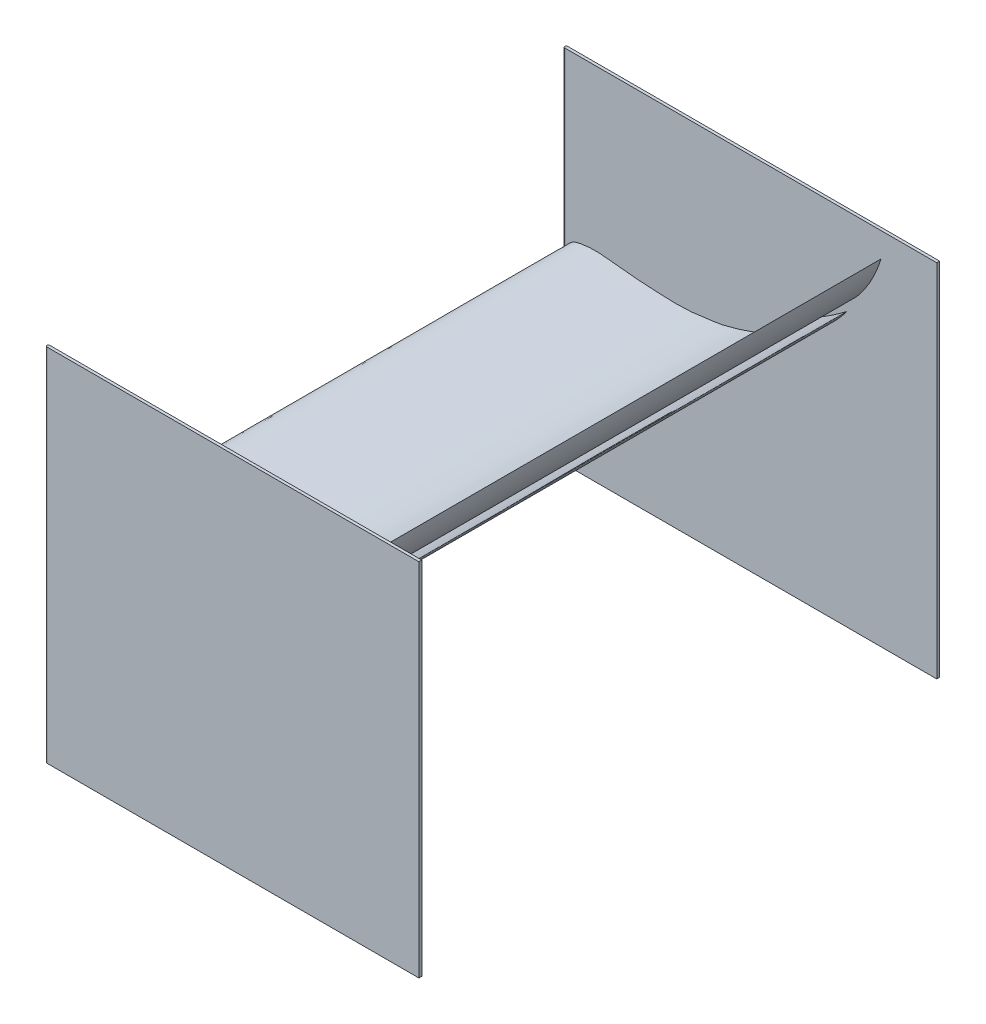
from build123d import *

# Parameters (mm, degrees)
BOSS_EXTRUDE1_DEPTH   = 900
BOSS_EXTRUDE1_2_DEPTH = 900
BOSS_EXTRUDE1_3_DEPTH = 900
SKETCH3_W             = 650
SKETCH3_H             = 630
BOSS_EXTRUDE2_DEPTH   = 5
SKETCH5_W             = 650
SKETCH5_H             = 630
BOSS_EXTRUDE3_DEPTH   = 5
BOSS_EXTRUDE4_DEPTH   = 630


with BuildPart() as part:
    # Sketch2 → Boss-Extrude1 (new body)
    with BuildSketch(Plane.XY):
        with BuildLine():
            add(Edge.make_bspline(
                [(0, 0), (-0.65975565, -5.699703464), (8.017548516, -15.480562025), (19.551157506, -21.724015646), (30.016745353, -25.302215165), (39.859962541, -28.8642232), (50.040399275, -30.662933418), (60.070603806, -32.257702331), (70.013877162, -34.217674322), (80.100972933, -34.55999195), (90.093066457, -35.36519438), (100.111969814, -35.952943269), (110.128217778, -35.507216678), (120.153157744, -35.210003546), (130.150331683, -34.229800116), (140.189993261, -33.410162922), (150.178235204, -31.913406007), (160.170449627, -30.371338734), (170.240789754, -29.163640841), (180.208316099, -27.151030087), (190.263801281, -25.306120223), (200.239152099, -22.872450662), (210.244577583, -20.429111012), (220.232934245, -17.895088966), (230.381125348, -15.705438437), (240.351948949, -12.391144832), (253.551193017, -7.369638816), (266.947574476, -2.806549313), (280.436865809, 1.636643436), (290.361357742, 5.819516769), (300.440735094, 10.032227759), (310.304777653, 14.884053202), (323.821431636, 20.884190166), (337.30228202, 27.249833417), (350.274680503, 34.850235797), (364.037447664, 41.200679435), (378.073354269, 50.431878374), (389.268655411, 56.991671546), (404.933124868, 70.670428585), (388.893146181, 60.897261379), (380.961681237, 56.833339948), (370.316551331, 52.173205743), (360.413556578, 47.749137904), (350.469658047, 43.075442492), (340.496714174, 38.833200032), (330.405194537, 35.260956145), (320.349773519, 31.849438488), (310.358327921, 28.32591748), (300.486931551, 24.662169398), (290.321799777, 22.300639283), (280.290360105, 19.76188557), (270.426731207, 16.765017679), (260.335958512, 15.061341224), (250.276874186, 13.958758108), (240.266180313, 12.578254982), (230.278688892, 11.06786106), (220.28670052, 9.696364143), (210.243264635, 9.240413966), (200.228739037, 9.034505305), (190.217040672, 8.279165066), (180.212460889, 9.162360851), (170.184221628, 8.728504773), (160.186505008, 9.582197967), (150.167787888, 9.989196896), (140.163470123, 10.700746944), (130.145958281, 11.214450998), (120.121382338, 11.840881885), (110.132801048, 12.969737489), (100.114836916, 13.850136605), (90.093770057, 14.715857774), (80.079633724, 15.842660607), (56.917746978, 18.847498868), (32.382831952, 18.963380484), (8.41761673, 12.262874152), (0.546057517, 4.717452477), (0, 0)],
                knots=[0, 0, 0, 0, 0.022023736, 0.035622153, 0.048196888, 0.060584536, 0.072602109, 0.084545422, 0.096478612, 0.108283816, 0.120089627, 0.131879307, 0.143660654, 0.15544949, 0.167268546, 0.17910001, 0.190991158, 0.20289685, 0.214787999, 0.226765538, 0.23876847, 0.250863752, 0.262991876, 0.27512, 0.287234564, 0.299600692, 0.31214973, 0.337081787, 0.34954249, 0.362249466, 0.375072168, 0.388091419, 0.401030286, 0.427260863, 0.440708926, 0.453891579, 0.481343844, 0.495528159, 0.510184265, 0.522427916, 0.535732546, 0.548643086, 0.561553626, 0.574510663, 0.587286643, 0.599816472, 0.612271303, 0.624763182, 0.637218013, 0.649381244, 0.661544475, 0.673750263, 0.685718325, 0.697586388, 0.709471547, 0.721375261, 0.733243324, 0.745039761, 0.756824219, 0.768610895, 0.780397571, 0.792175284, 0.803971722, 0.815766061, 0.82756692, 0.839363385, 0.851169099, 0.863005976, 0.874833225, 0.886659586, 0.898509641, 0.910371212, 0.969295412, 0.981771696, 1, 1, 1, 1], degree=3))
        make_face()
    extrude(amount=BOSS_EXTRUDE1_DEPTH)



with BuildPart() as body_2:
    # Sketch2 → Boss-Extrude1 2 (new body)
    with BuildSketch(Plane.XY):
        with BuildLine():
            add(Edge.make_bspline(
                [(488.73992863, 146.276625829), (488.734390863, 146.282664356), (488.424255517, 146.015046997), (488.06224571, 145.78510435), (487.262468982, 145.126312202), (486.219708703, 144.371292999), (484.873478649, 143.336701677), (483.250678892, 142.116067573), (481.344943871, 140.702556836), (479.183854282, 139.108333078), (476.761259361, 137.364331889), (474.123745832, 135.449437464), (471.236790602, 133.439330858), (468.165688429, 131.291310186), (464.896239769, 129.067635846), (461.457519682, 126.769533617), (457.874048726, 124.410588123), (454.151349507, 122.026984888), (450.329646269, 119.608278587), (446.41836705, 117.19210493), (442.442349173, 114.792641259), (438.43193703, 112.415341988), (434.42114363, 110.058907294), (430.419325782, 107.74839744), (426.469079038, 105.475179612), (422.572434597, 103.270040027), (418.782946314, 101.105445668), (415.103822048, 99.01892845), (411.581105321, 96.980001912), (408.223119368, 95.024650916), (405.070149132, 93.117181313), (402.117764879, 91.312769814), (399.415735867, 89.554324386), (396.965291652, 87.893504979), (394.792388291, 86.318571947), (392.915837215, 84.829964237), (391.349809227, 83.430905822), (390.083467317, 82.150893966), (389.152598068, 80.964624913), (388.566460536, 79.872034746), (388.31048608, 78.86894122), (388.452520239, 77.947544055), (389.013376817, 77.204475769), (389.915554573, 76.684991476), (391.128157446, 76.384212118), (392.650081725, 76.254634507), (394.48507873, 76.313765499), (396.623198675, 76.579439281), (399.045948072, 77.035742523), (401.735792151, 77.720460618), (404.675674285, 78.596752435), (407.839178956, 79.704940552), (411.200777121, 81.026852514), (414.720896472, 82.590974299), (418.395557374, 84.341793332), (422.179917585, 86.309143039), (426.045683707, 88.480043342), (429.970357242, 90.828820323), (433.914957703, 93.364526939), (437.871228384, 96.040204149), (441.793376071, 98.866131635), (445.668479549, 101.797178284), (449.465692449, 104.827226536), (453.167907327, 107.924049831), (456.76145535, 111.053999458), (460.202936902, 114.219487851), (463.519091154, 117.342970547), (466.650128692, 120.455005022), (469.613566921, 123.489837804), (472.370170636, 126.450937081), (474.953957291, 129.265647603), (477.297780382, 131.960513478), (479.456204478, 134.463515761), (481.381106749, 136.784579704), (483.077897662, 138.897364919), (484.557730654, 140.769579134), (485.809879979, 142.38248786), (486.847928071, 143.738913606), (487.625844434, 144.768628828), (488.251100258, 145.595659419), (488.480713959, 145.957078055), (488.74539046, 146.270670107), (488.73992863, 146.276625829)],
                knots=[0, 0, 0, 0, 0.000781199, 0.003073574, 0.006930933, 0.012248071, 0.019030102, 0.027225991, 0.036784991, 0.047610037, 0.059602429, 0.072763906, 0.086896902, 0.102003859, 0.117938515, 0.134556032, 0.151857595, 0.169650659, 0.187837924, 0.206373783, 0.225065344, 0.243814112, 0.262569213, 0.281136751, 0.299513586, 0.317505655, 0.335105223, 0.352118009, 0.368487898, 0.384166869, 0.39895523, 0.412906354, 0.425871787, 0.437810597, 0.448585292, 0.458212857, 0.466668993, 0.473884465, 0.479894259, 0.484778924, 0.488742849, 0.492166792, 0.495627983, 0.499576303, 0.504486665, 0.51057614, 0.517942731, 0.526573967, 0.536524046, 0.547640111, 0.560015283, 0.573490911, 0.58803144, 0.603543533, 0.619911609, 0.637089411, 0.654944026, 0.673346428, 0.692212491, 0.711460838, 0.730910148, 0.750475101, 0.77002178, 0.789460649, 0.808651173, 0.827457923, 0.845819698, 0.863558965, 0.880665567, 0.896944906, 0.912322084, 0.926717772, 0.939992516, 0.952161421, 0.963060032, 0.972661788, 0.980906352, 0.987732879, 0.993080076, 0.996902186, 0.999229514, 1, 1, 1, 1], degree=3))
        make_face()
    extrude(amount=BOSS_EXTRUDE1_2_DEPTH)


with BuildPart() as body_3:
    # Sketch2 → Boss-Extrude1 3 (new body)
    with BuildSketch(Plane.XY):
        with BuildLine():
            add(Edge.make_bspline(
                [(548.142677429, 255.362022493), (548.135374227, 255.365952606), (547.927936153, 255.006923964), (547.658371583, 254.666651265), (547.113002911, 253.770748213), (546.367364831, 252.702005657), (545.424638558, 251.265023805), (544.27941979, 249.558165284), (542.927897021, 247.572779047), (541.392389605, 245.329670238), (539.656724271, 242.856366084), (537.77246287, 240.148181213), (535.681420522, 237.265978202), (533.460225952, 234.1906606), (531.074588655, 230.97702341), (528.551895931, 227.635912658), (525.911068883, 224.188473742), (523.145346923, 220.671136821), (520.29665909, 217.087300279), (517.361495783, 213.476080086), (514.358883712, 209.859293663), (511.316016626, 206.252251869), (508.265842752, 202.665029322), (505.208968651, 199.124696426), (502.1889872, 195.637173296), (499.197596623, 192.232566763), (496.295154414, 188.902374923), (493.472239146, 185.683544867), (490.783011296, 182.562252326), (488.223454385, 179.575667492), (485.843956575, 176.703071592), (483.621924068, 173.995738505), (481.623931594, 171.41564926), (479.833965661, 169.012598811), (478.280745879, 166.784000715), (476.982109533, 164.736533764), (475.9505309, 162.877995089), (475.165835333, 161.232977644), (474.670653437, 159.789198906), (474.473857946, 158.549678558), (474.562913108, 157.505571006), (475.005273255, 156.671993733), (475.788683212, 156.148250847), (476.823995566, 155.951818146), (478.083297743, 156.067751239), (479.581340455, 156.450270824), (481.315884792, 157.117361276), (483.27148496, 158.082761094), (485.435756441, 159.325104089), (487.779363945, 160.874677932), (490.298259918, 162.690587977), (492.953775055, 164.80259248), (495.727550679, 167.184824621), (498.572278285, 169.851349424), (501.502624239, 172.747773867), (504.46579375, 175.887697633), (507.439057803, 179.249297912), (510.409450838, 182.800544998), (513.336696107, 186.537123271), (516.228525151, 190.411393589), (519.037740226, 194.417946242), (521.767005491, 198.509337516), (524.388867963, 202.669455575), (526.897696092, 206.861800297), (529.291618766, 211.049656155), (531.528344155, 215.220888935), (533.659235885, 219.310264722), (535.616969063, 223.327101968), (537.440168258, 227.214370322), (539.090171449, 230.962330487), (540.623673351, 234.512844247), (541.967651222, 237.868945421), (543.198230675, 240.979940777), (544.266104832, 243.839306635), (545.18521028, 246.423662369), (545.97695415, 248.705848341), (546.637316417, 250.664385968), (547.178342468, 252.306492823), (547.579395063, 253.549717004), (547.901947032, 254.548383811), (548.001197383, 254.970292394), (548.149880485, 255.358146272), (548.142677429, 255.362022493)],
                knots=[0, 0, 0, 0, 0.000781199, 0.003073574, 0.006930933, 0.012248071, 0.019030102, 0.027225991, 0.036784991, 0.047610037, 0.059602429, 0.072763906, 0.086896902, 0.102003859, 0.117938515, 0.134556032, 0.151857595, 0.169650659, 0.187837924, 0.206373783, 0.225065344, 0.243814112, 0.262569213, 0.281136751, 0.299513586, 0.317505655, 0.335105223, 0.352118009, 0.368487898, 0.384166869, 0.39895523, 0.412906354, 0.425871787, 0.437810597, 0.448585292, 0.458212857, 0.466668993, 0.473884465, 0.479894259, 0.484778924, 0.488742849, 0.492166792, 0.495627983, 0.499576303, 0.504486665, 0.51057614, 0.517942731, 0.526573967, 0.536524046, 0.547640111, 0.560015283, 0.573490911, 0.58803144, 0.603543533, 0.619911609, 0.637089411, 0.654944026, 0.673346428, 0.692212491, 0.711460838, 0.730910148, 0.750475101, 0.77002178, 0.789460649, 0.808651173, 0.827457923, 0.845819698, 0.863558965, 0.880665567, 0.896944906, 0.912322084, 0.926717772, 0.939992516, 0.952161421, 0.963060032, 0.972661788, 0.980906352, 0.987732879, 0.993080076, 0.996902186, 0.999229514, 1, 1, 1, 1], degree=3))
        make_face()
    extrude(amount=BOSS_EXTRUDE1_3_DEPTH)


with BuildPart() as part_1:
    add(part.part)

    add(body_2.part)  # Boss-Extrude2 merges body 2

    add(body_3.part)  # Boss-Extrude2 merges body 3
    # Sketch3 → Boss-Extrude2 (add)
    with BuildSketch(Plane.XY.offset(900)):
        with Locations((320.596618382, -16.625673365)):
            Rectangle(SKETCH3_W, SKETCH3_H)
    extrude(amount=BOSS_EXTRUDE2_DEPTH)

    # Sketch5 → Boss-Extrude3 (add)
    with BuildSketch(Plane.XY):
        with Locations((320.596618382, -16.625673365)):
            Rectangle(SKETCH5_W, SKETCH5_H)
    extrude(amount=-BOSS_EXTRUDE3_DEPTH)

    # Sketch8 → Boss-Extrude4 (add)
    with BuildSketch(Plane(origin=(0, 298.374326635, 0), x_dir=(1, 0, 0), z_dir=(0, 1, 0))):
        with BuildLine():
            Line((-4.403381618, -900), (-4.403381618, -905))
            ThreePointArc((-4.403381618, -905), (-6.903381618, -902.5), (-4.403381618, -900))
        make_face()
        with BuildLine():
            Line((-4.403381618, 5), (-4.403381618, 0))
            ThreePointArc((-4.403381618, 0), (-6.903381618, 2.5), (-4.403381618, 5))
        make_face()
    extrude(amount=-BOSS_EXTRUDE4_DEPTH)


solid = part_1.part
